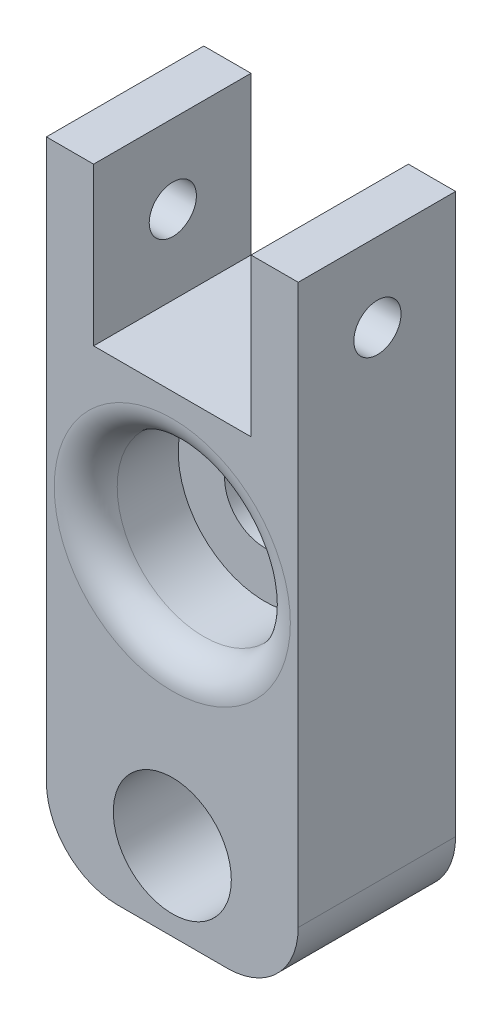
from build123d import *

# Parameters (mm, degrees)
SKETCH1_W           = 32
SKETCH1_H           = 60
BOSS_EXTRUDE1_DEPTH = 20
SKETCH2_R           = 7.5
SKETCH2_R_2         = 5.1
CUT_EXTRUDE1_DEPTH  = 401.819161219
SKETCH3_R           = 11
CUT_EXTRUDE2_DEPTH  = 11.75
SKETCH4_W           = 6
SKETCH4_H           = 20
BOSS_EXTRUDE2_DEPTH = 20
SKETCH5_R           = 3
CUT_EXTRUDE3_DEPTH  = 402.776057027
FILLET2_R           = 9
FILLET3_R           = 4


with BuildPart() as part:
    # Sketch1 → Boss-Extrude1 (new body)
    with BuildSketch(Plane.XY):
        with Locations((0, -370)):
            Rectangle(SKETCH1_W, SKETCH1_H)
    extrude(amount=-BOSS_EXTRUDE1_DEPTH)

    # Sketch2 → Cut-Extrude1 (cut, through all)
    with BuildSketch(Plane.XY):
        with Locations((0, -390)):
            Circle(SKETCH2_R)
        with Locations((0, -358)):
            Circle(SKETCH2_R_2)
    extrude(amount=-CUT_EXTRUDE1_DEPTH, mode=Mode.SUBTRACT)

    # Sketch3 → Cut-Extrude2 (cut)
    with BuildSketch(Plane.XY):
        with Locations((0, -358)):
            Circle(SKETCH3_R)
    extrude(amount=-CUT_EXTRUDE2_DEPTH, mode=Mode.SUBTRACT)

    # Sketch4 → Boss-Extrude2 (add)
    with BuildSketch(Plane(origin=(0, -340, 0), x_dir=(1, 0, 0), z_dir=(0, 1, 0))):
        with Locations((13, 10)):
            Rectangle(SKETCH4_W, SKETCH4_H)
        with Locations((-13, 10)):
            Rectangle(SKETCH4_W, SKETCH4_H)
    extrude(amount=BOSS_EXTRUDE2_DEPTH)

    # Sketch5 → Cut-Extrude3 (cut, through all)
    with BuildSketch(Plane.ZY.offset(16)):
        with Locations((-10.065765089, -330)):
            Circle(SKETCH5_R)
    extrude(amount=-CUT_EXTRUDE3_DEPTH, mode=Mode.SUBTRACT)

    # Fillet2
    fillet2_edges = [part.edges().sort_by_distance(p)[0] for p in [
        (16, -400, -10),
        (-16, -400, -10),
    ]]
    fillet(fillet2_edges, radius=FILLET2_R)

    # Fillet3
    fillet3_edges = [part.edges().sort_by_distance(p)[0] for p in [
        (-11, -358, 0),
    ]]
    fillet(fillet3_edges, radius=FILLET3_R)


solid = part.part
